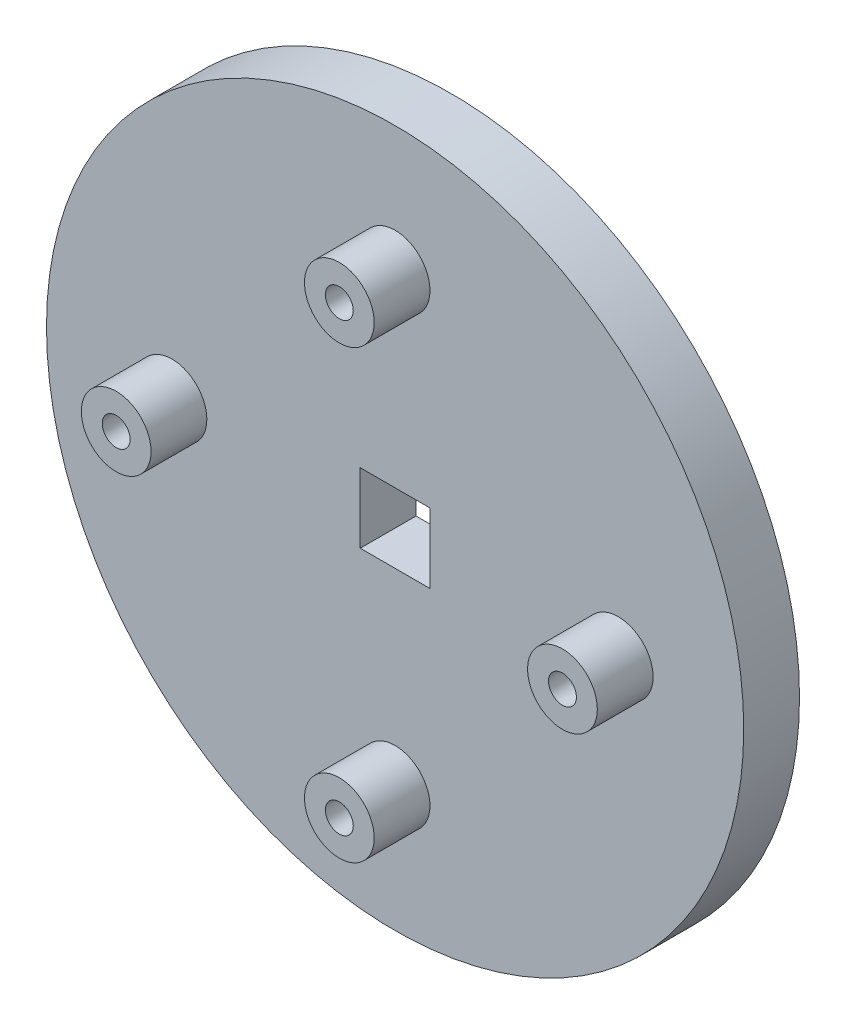
from build123d import *

# Parameters (mm, degrees)
SKETCH_1_R          = 50
EXTRUDE_1_DEPTH     = 8
SKETCH_2_W          = 10
SKETCH_2_H          = 10
CUT_EXTRUDE_1_DEPTH = 8
SKETCH_3_R          = 5
SKETCH_3_R_2        = 2
EXTRUDE_3_DEPTH     = 8


with BuildPart() as part:
    # 草图1 → 凸台-拉伸1 (new body)
    with BuildSketch(Plane.XY):
        Circle(SKETCH_1_R)
    extrude(amount=EXTRUDE_1_DEPTH)

    # 草图2 → 切除-拉伸1 (cut)
    with BuildSketch(Plane.XY.offset(8)):
        Rectangle(SKETCH_2_W, SKETCH_2_H)
    extrude(amount=-CUT_EXTRUDE_1_DEPTH, mode=Mode.SUBTRACT)

    # 草图3 → 凸台-拉伸3 (add)
    # profile 1 of 4: a face of its own
    with BuildSketch(Plane.XY.offset(8)):
        with Locations((0, 32)):
            Circle(SKETCH_3_R)
        with Locations((0, 32)):
            Circle(SKETCH_3_R_2, mode=Mode.SUBTRACT)
    # profile 2 of 4: a face of its own
    with BuildSketch(Plane.XY.offset(8)):
        with Locations((32, 0)):
            Circle(SKETCH_3_R)
        with Locations((32, 0)):
            Circle(SKETCH_3_R_2, mode=Mode.SUBTRACT)
    # profile 3 of 4: a face of its own
    with BuildSketch(Plane.XY.offset(8)):
        with Locations((0, -32)):
            Circle(SKETCH_3_R)
        with Locations((0, -32)):
            Circle(SKETCH_3_R_2, mode=Mode.SUBTRACT)
    # profile 4 of 4: a face of its own
    with BuildSketch(Plane.XY.offset(8)):
        with Locations((-32, 0)):
            Circle(SKETCH_3_R)
        with Locations((-32, 0)):
            Circle(SKETCH_3_R_2, mode=Mode.SUBTRACT)
    extrude(amount=EXTRUDE_3_DEPTH)


solid = part.part
